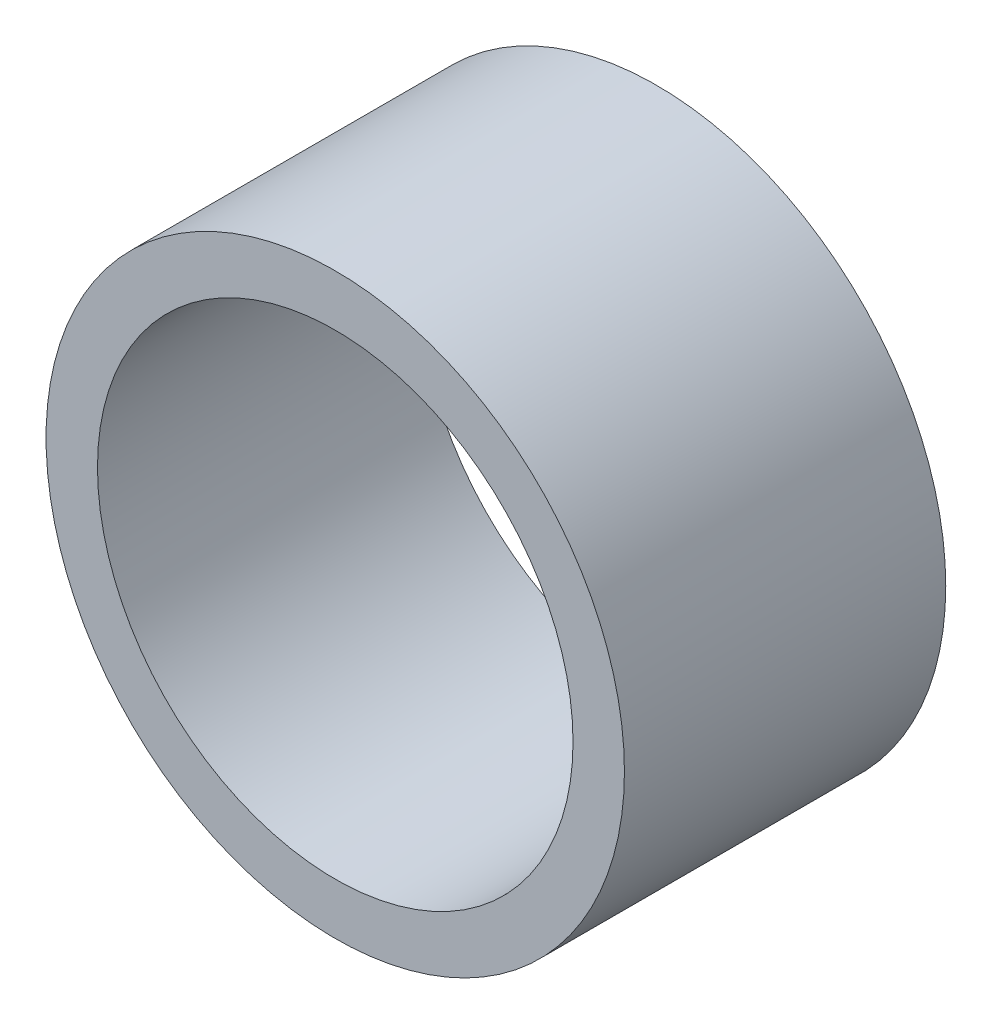
from build123d import *

# Parameters (mm, degrees)
SKETCH1_R           = 4.5
SKETCH1_R_2         = 3.7
BOSS_EXTRUDE1_DEPTH = 5


with BuildPart() as part:
    # Sketch1 → Boss-Extrude1 (new body)
    with BuildSketch(Plane.XY):
        Circle(SKETCH1_R)
        Circle(SKETCH1_R_2, mode=Mode.SUBTRACT)
    extrude(amount=BOSS_EXTRUDE1_DEPTH)


solid = part.part
